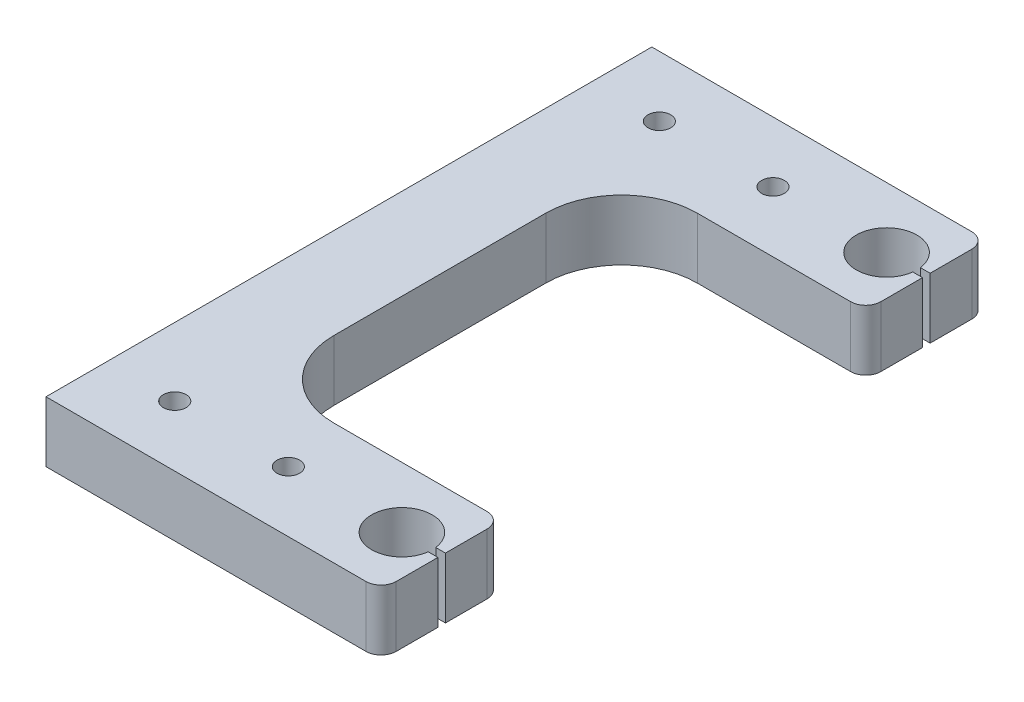
from build123d import *

# Parameters (mm, degrees)
SKETCH1_R           = 4
SKETCH1_R_2         = 1.5
BOSS_EXTRUDE1_DEPTH = 8
CUT_EXTRUDE2_DEPTH  = 92.771795776
FILLET1_R           = 2
FILLET2_R           = 10


with BuildPart() as part:
    # Sketch1 → Boss-Extrude1 (new body)
    with BuildSketch(Plane(origin=(0, 0, 0), x_dir=(1, 0, 0), z_dir=(0, 1, 0))):
        Polygon((0, 0), (0, -80), (44.25, -80), (44.25, -64), (12, -64), (12, -16), (44.25, -16), (44.25, 0), align=None)
        with Locations(Location((39, -8, 0), (0, 0, 270))):
            Circle(SKETCH1_R, mode=Mode.SUBTRACT)
        with Locations(Location((39, -72, 0), (0, 0, 90))):
            Circle(SKETCH1_R, mode=Mode.SUBTRACT)
        with Locations(Location((24, -8, 0), (0, 0, 270))):
            Circle(SKETCH1_R_2, mode=Mode.SUBTRACT)
        with Locations(Location((9, -8, 0), (0, 0, 270))):
            Circle(SKETCH1_R_2, mode=Mode.SUBTRACT)
        with Locations(Location((24, -72, 0), (0, 0, 90))):
            Circle(SKETCH1_R_2, mode=Mode.SUBTRACT)
        with Locations(Location((9, -72, 0), (0, 0, 90))):
            Circle(SKETCH1_R_2, mode=Mode.SUBTRACT)
    extrude(amount=BOSS_EXTRUDE1_DEPTH)

    # Sketch4 → Cut-Extrude2 (cut, through all)
    with BuildSketch(Plane(origin=(0, 8, 0), x_dir=(1, 0, 0), z_dir=(0, 1, 0))):
        with BuildLine():
            Line((39, -7.5), (44.25, -7.5))
            ThreePointArc((44.25, -7.5), (44.75, -8), (44.25, -8.5))
            Line((44.25, -8.5), (39, -8.5))
            ThreePointArc((39, -8.5), (38.5, -8), (39, -7.5))
        make_face()
        with BuildLine():
            Line((39, -71.5), (44.25, -71.5))
            ThreePointArc((44.25, -71.5), (44.75, -72), (44.25, -72.5))
            Line((44.25, -72.5), (39, -72.5))
            ThreePointArc((39, -72.5), (38.5, -72), (39, -71.5))
        make_face()
    extrude(amount=-CUT_EXTRUDE2_DEPTH, mode=Mode.SUBTRACT)

    # Fillet1
    fillet1_edges = [part.edges().sort_by_distance(p)[0] for p in [
        (44.25, 4, 0),
        (44.25, 4, 16),
        (44.25, 4, 64),
        (44.25, 4, 80),
    ]]
    fillet(fillet1_edges, radius=FILLET1_R)

    # Fillet2
    fillet2_edges = [part.edges().sort_by_distance(p)[0] for p in [
        (12, 4, 16),
        (12, 4, 64),
    ]]
    fillet(fillet2_edges, radius=FILLET2_R)


solid = part.part
